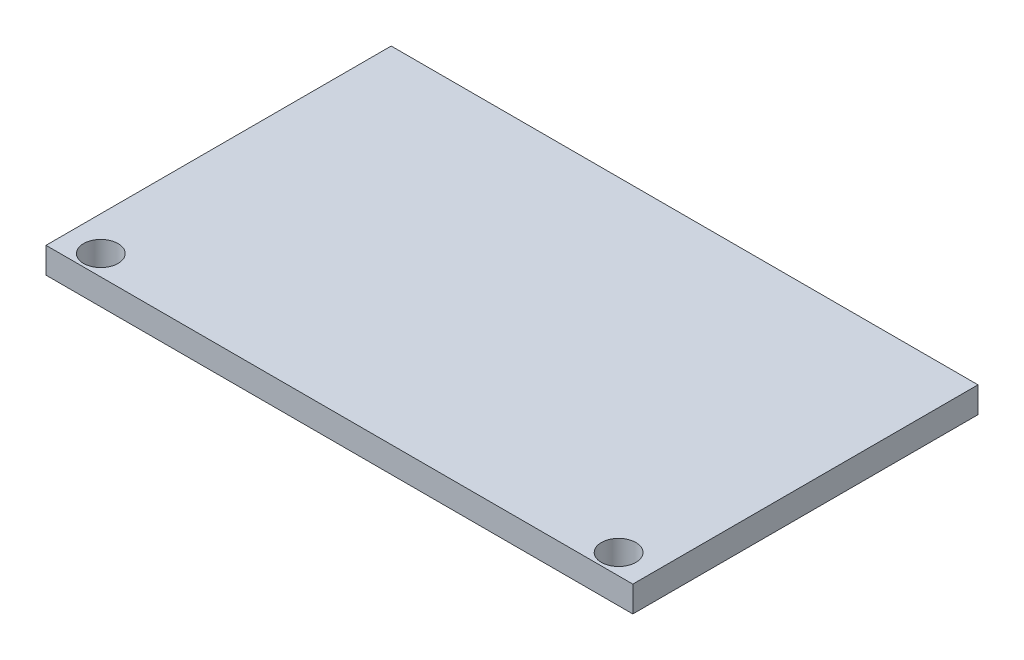
from build123d import *

# Parameters (mm, degrees)
SKETCH2_W           = 34
SKETCH2_H           = 20
SKETCH2_R           = 1
BOSS_EXTRUDE1_DEPTH = 1.5


with BuildPart() as part:
    # Sketch2 → Boss-Extrude1 (new body)
    with BuildSketch(Plane(origin=(0, 0, 0), x_dir=(1, 0, 0), z_dir=(0, 1, 0))):
        Rectangle(SKETCH2_W, SKETCH2_H)
        with Locations(Location((-15, -8.823529412, 0), (0, 0, 270))):
            Circle(SKETCH2_R, mode=Mode.SUBTRACT)
        with Locations(Location((15, -8.823529412, 0), (0, 0, 270))):
            Circle(SKETCH2_R, mode=Mode.SUBTRACT)
    extrude(amount=BOSS_EXTRUDE1_DEPTH)


solid = part.part
